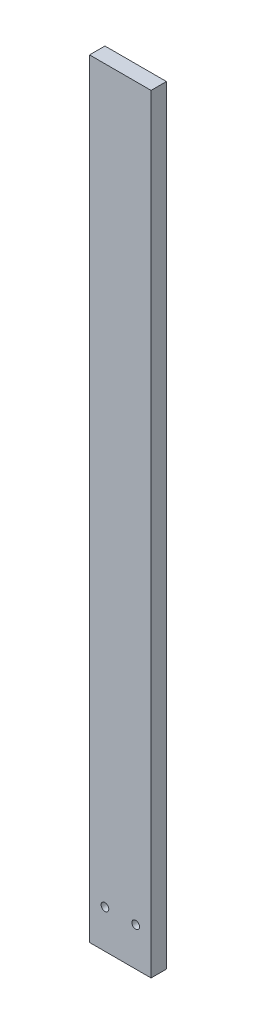
from build123d import *

# Parameters (mm, degrees)
SKETCH1_W           = 40
SKETCH1_H           = 500
BOSS_EXTRUDE1_DEPTH = 10
SKETCH2_R           = 2.5
CUT_EXTRUDE1_DEPTH  = 251.99800796


with BuildPart() as part:
    # Sketch1 → Boss-Extrude1 (new body)
    with BuildSketch(Plane.XY):
        Rectangle(SKETCH1_W, SKETCH1_H)
    extrude(amount=BOSS_EXTRUDE1_DEPTH)

    # Sketch2 → Cut-Extrude1 (cut, through all)
    with BuildSketch(Plane(origin=(0, 0, 0), x_dir=(-1, 0, 0), z_dir=(0, 0, -1))):
        with Locations((10, -225)):
            Circle(SKETCH2_R)
        with Locations(Location((-10, -225, 0), (0, 0, 180))):
            Circle(SKETCH2_R)
    extrude(amount=-CUT_EXTRUDE1_DEPTH, mode=Mode.SUBTRACT)


solid = part.part
